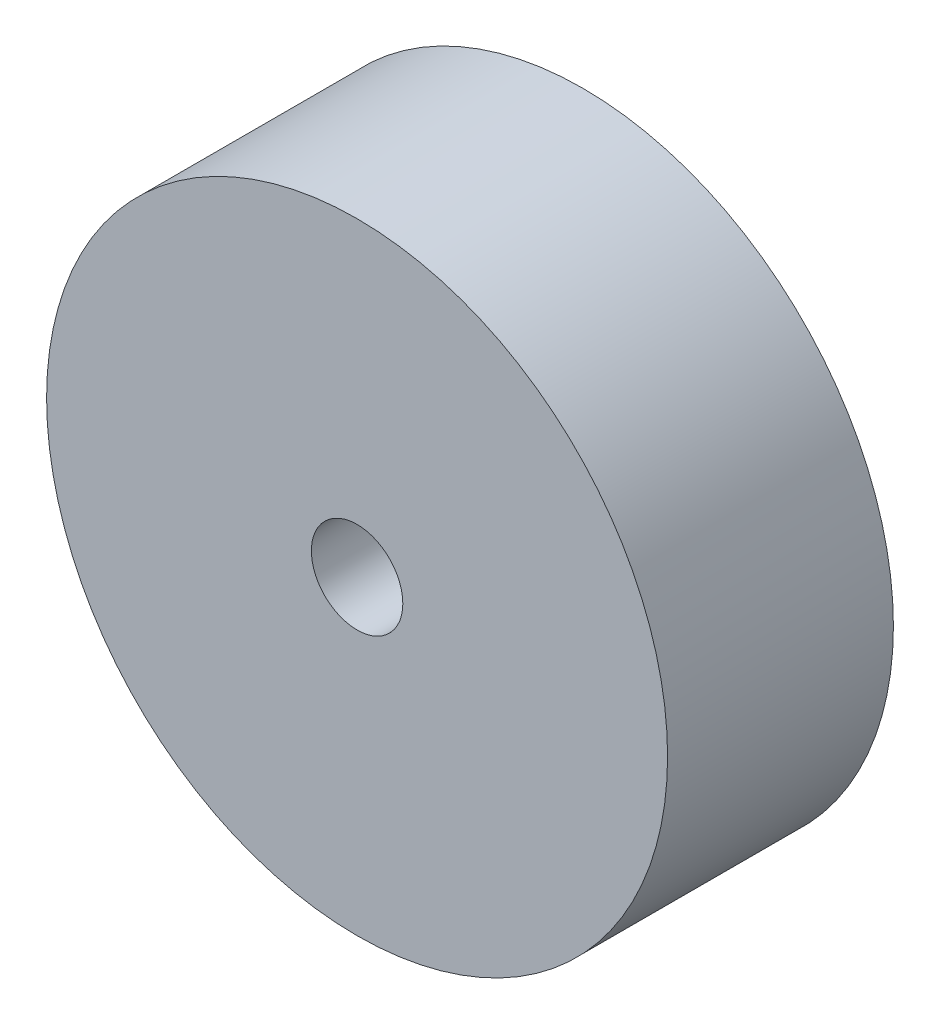
from build123d import *

# Parameters (mm, degrees)
CROQUIS1_R              = 27.5
SALIENTE_EXTRUIR1_DEPTH = 10
CROQUIS4_R              = 4.05
CORTAR_EXTRUIR2_DEPTH   = 108


with BuildPart() as part:
    # Croquis1 → Saliente-Extruir1 (new, symmetric)
    with BuildSketch(Plane.XY):
        Circle(CROQUIS1_R)
    extrude(amount=SALIENTE_EXTRUIR1_DEPTH, both=True)

    # Croquis4 → Cortar-Extruir2 (cut)
    with BuildSketch(Plane.XY.offset(10)):
        Circle(CROQUIS4_R)
    extrude(amount=-CORTAR_EXTRUIR2_DEPTH, mode=Mode.SUBTRACT)


solid = part.part
